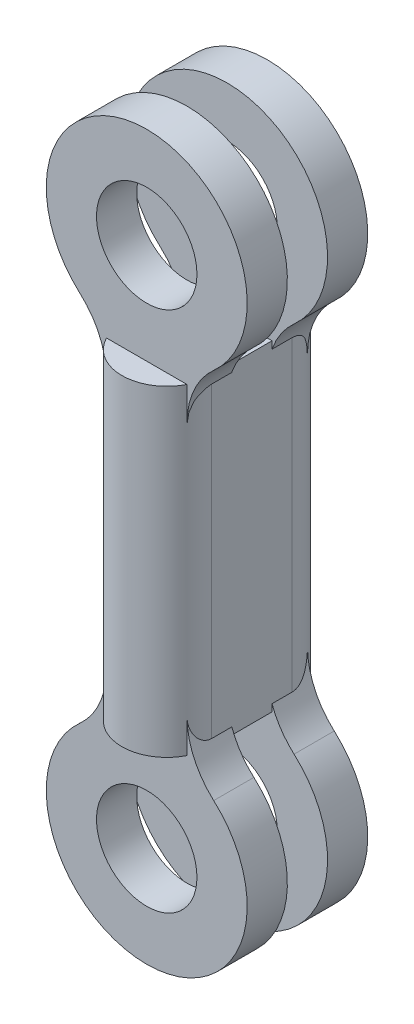
from build123d import *

# Parameters (mm, degrees)
BOSS_EXTRUDE1_START   = 2.5
SKETCH1_R             = 6.25
BOSS_EXTRUDE1_DEPTH   = 5
BOSS_EXTRUDE1_2_DEPTH = 5
BOSS_EXTRUDE2_START   = -2.5
SKETCH1_2_R           = 6.25
BOSS_EXTRUDE2_DEPTH   = 5
BOSS_EXTRUDE2_2_DEPTH = 5
BOSS_EXTRUDE3_START   = 12.5
BOSS_EXTRUDE3_DEPTH   = 40
SKETCH3_R             = 1.5
CUT_EXTRUDE1_DEPTH    = 64


with BuildPart() as part:
    # Sketch1 → Boss-Extrude1 (new body)
    with BuildSketch(Plane.XY.offset(BOSS_EXTRUDE1_START)):
        with BuildLine():
            Line((5, 16.770509831), (5, 18.456439237))
            Line((5, 18.456439237), (-5, 18.456439237))
            Line((-5, 18.456439237), (-5, 16.770509831))
            ThreePointArc((-5, 16.770509831), (-5.871290708, 12.688026927), (-8.333333333, 9.316949906))
            ThreePointArc((-8.333333333, 9.316949906), (0, -12.5), (8.333333333, 9.316949906))
            ThreePointArc((8.333333333, 9.316949906), (5.871290708, 12.688026927), (5, 16.770509831))
        make_face()
        Circle(SKETCH1_R, mode=Mode.SUBTRACT)
    extrude(amount=BOSS_EXTRUDE1_DEPTH)



with BuildPart() as body_2:
    # Sketch1 → Boss-Extrude1 2 (new body)
    with BuildSketch(Plane.XY.offset(BOSS_EXTRUDE1_START)):
        with BuildLine():
            Line((-5, 48.229490169), (-5, 46.543560763))
            Line((-5, 46.543560763), (5, 46.543560763))
            Line((5, 46.543560763), (5, 48.229490169))
            ThreePointArc((5, 48.229490169), (5.871290708, 52.311973073), (8.333333333, 55.683050094))
            ThreePointArc((8.333333333, 55.683050094), (0, 77.5), (-8.333333333, 55.683050094))
            ThreePointArc((-8.333333333, 55.683050094), (-5.871290708, 52.311973073), (-5, 48.229490169))
        make_face()
        with Locations((0, 65)):
            Circle(SKETCH1_R, mode=Mode.SUBTRACT)
    extrude(amount=BOSS_EXTRUDE1_2_DEPTH)


with BuildPart() as body_3:
    # Sketch1<2> → Boss-Extrude2 (new body)
    with BuildSketch(Plane.XY.offset(BOSS_EXTRUDE2_START)):
        with BuildLine():
            Line((5, 16.770509831), (5, 18.456439237))
            Line((5, 18.456439237), (-5, 18.456439237))
            Line((-5, 18.456439237), (-5, 16.770509831))
            ThreePointArc((-5, 16.770509831), (-5.871290708, 12.688026927), (-8.333333333, 9.316949906))
            ThreePointArc((-8.333333333, 9.316949906), (0, -12.5), (8.333333333, 9.316949906))
            ThreePointArc((8.333333333, 9.316949906), (5.871290708, 12.688026927), (5, 16.770509831))
        make_face()
        Circle(SKETCH1_2_R, mode=Mode.SUBTRACT)
    extrude(amount=-BOSS_EXTRUDE2_DEPTH)


with BuildPart() as body_4:
    # Sketch1<2> → Boss-Extrude2 2 (new body)
    with BuildSketch(Plane.XY.offset(BOSS_EXTRUDE2_START)):
        with BuildLine():
            Line((-5, 48.229490169), (-5, 46.543560763))
            Line((-5, 46.543560763), (5, 46.543560763))
            Line((5, 46.543560763), (5, 48.229490169))
            ThreePointArc((5, 48.229490169), (5.871290708, 52.311973073), (8.333333333, 55.683050094))
            ThreePointArc((8.333333333, 55.683050094), (0, 77.5), (-8.333333333, 55.683050094))
            ThreePointArc((-8.333333333, 55.683050094), (-5.871290708, 52.311973073), (-5, 48.229490169))
        make_face()
        with Locations((0, 65)):
            Circle(SKETCH1_2_R, mode=Mode.SUBTRACT)
    extrude(amount=-BOSS_EXTRUDE2_2_DEPTH)


with BuildPart() as part_1:
    add(part.part)

    add(body_3.part)  # Boss-Extrude3 merges body 3
    # Sketch2 → Boss-Extrude3 (add)
    with BuildSketch(Plane(origin=(0, 0, 0), x_dir=(1, 0, 0), z_dir=(0, 1, 0)).offset(BOSS_EXTRUDE3_START)):
        with BuildLine():
            Line((5.590169944, 5), (5.590169944, -5))
            ThreePointArc((5.590169944, -5), (0, -10.590169944), (-5.590169944, -5))
            Line((-5.590169944, -5), (-5.590169944, 5))
            ThreePointArc((-5.590169944, 5), (0, 10.590169944), (5.590169944, 5))
        make_face()
    extrude(amount=BOSS_EXTRUDE3_DEPTH)

    # Sketch3 → Cut-Extrude1 (cut)
    with BuildSketch(Plane.XZ.offset(-12.5)):
        Circle(SKETCH3_R)
    extrude(amount=-CUT_EXTRUDE1_DEPTH, mode=Mode.SUBTRACT)


solid = Compound([body_2.part, body_4.part, part_1.part])
